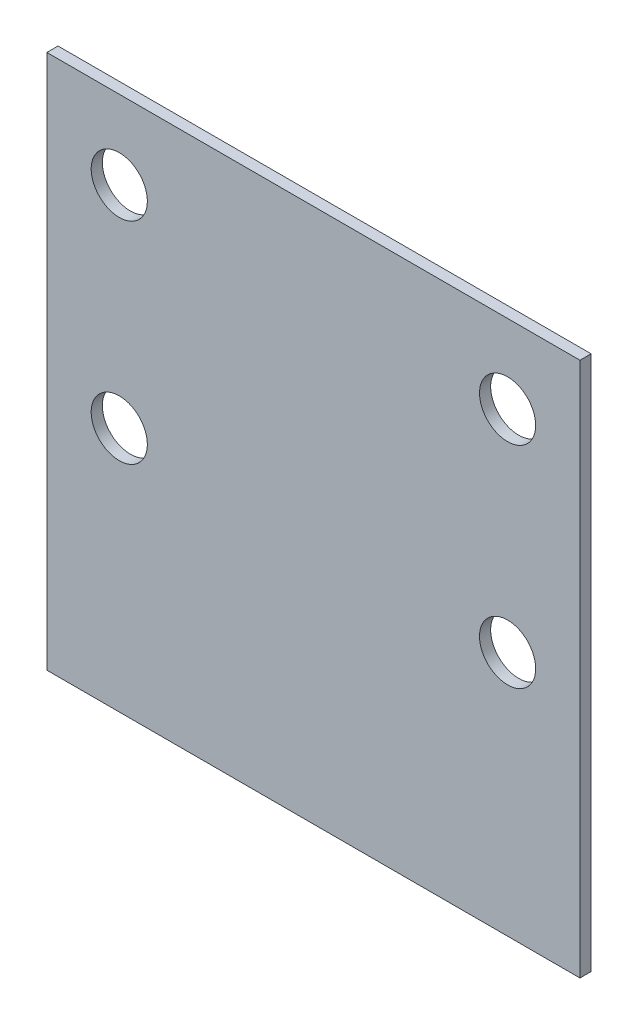
from build123d import *

# Parameters (mm, degrees)
SKETCH1_W           = 75.93
SKETCH1_H           = 76.2
SKETCH1_R           = 4
BOSS_EXTRUDE1_DEPTH = 1.5875


with BuildPart() as part:
    # Sketch1 → Boss-Extrude1 (new body)
    with BuildSketch(Plane.XY):
        with Locations((144.981356925, -266.342639432)):
            Rectangle(SKETCH1_W, SKETCH1_H)
        with Locations((117.328756925, -269.442639432)):
            Circle(SKETCH1_R, mode=Mode.SUBTRACT)
        with Locations((117.328756925, -239.442639432)):
            Circle(SKETCH1_R, mode=Mode.SUBTRACT)
        with Locations((172.633956925, -269.442639432)):
            Circle(SKETCH1_R, mode=Mode.SUBTRACT)
        with Locations((172.633956925, -239.442639432)):
            Circle(SKETCH1_R, mode=Mode.SUBTRACT)
    extrude(amount=BOSS_EXTRUDE1_DEPTH)


solid = part.part
